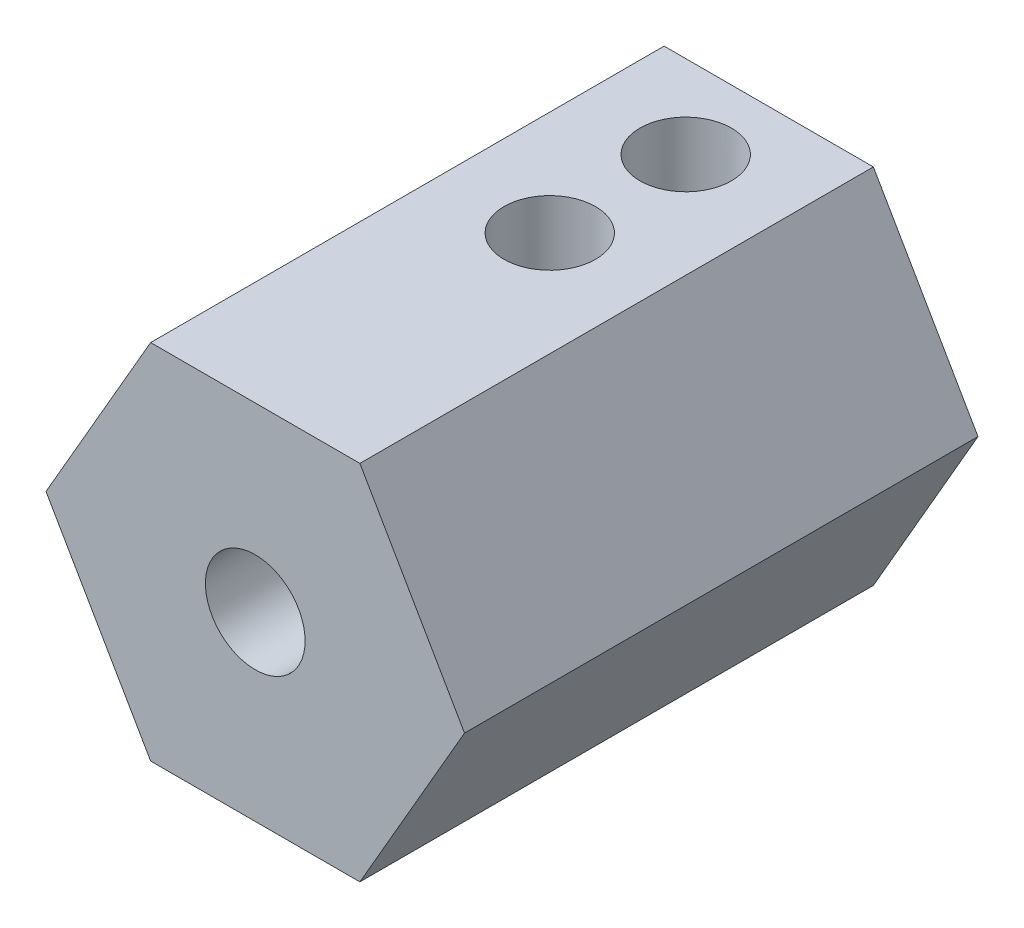
from build123d import *

# Parameters (mm, degrees)
F_01_17_MM_COMMERCIAL_DRIVE_HEX_DEPTH  = 17
F_02_START                             = -0.1
S02_SHAFT_SEAT_R                       = 2.025
F_02_SHAFT_SEAT_DEPTH                  = 10.1
F_03_START                             = 9.99
S03_OUTBOARD_M4_THREAD_ENVELOPE_R      = 1.65
F_03_OUTBOARD_M4_THREAD_ENVELOPE_DEPTH = 7.11
S04_RADIAL_M3_SET_SCREW_1_R            = 1.515
F_04_RADIAL_M3_SET_SCREW_1_DEPTH       = 7
S05_RADIAL_M3_SET_SCREW_2_R            = 1.515
F_05_RADIAL_M3_SET_SCREW_2_DEPTH       = 7


with BuildPart() as part:
    # S01 - 17 mm commercial drive hex → 01 - 17 mm commercial drive hex (new body)
    with BuildSketch(Plane.XY):
        Polygon((6.92820323, 0), (3.464101615, 6), (-3.464101615, 6), (-6.92820323, 0), (-3.464101615, -6), (3.464101615, -6), align=None)
    extrude(amount=F_01_17_MM_COMMERCIAL_DRIVE_HEX_DEPTH)

    # S02 - Shaft seat → 02 - Shaft seat (cut)
    with BuildSketch(Plane.XY.offset(F_02_START)):
        Circle(S02_SHAFT_SEAT_R)
    extrude(amount=F_02_SHAFT_SEAT_DEPTH, mode=Mode.SUBTRACT)

    # S03 - Outboard M4 thread envelope → 03 - Outboard M4 thread envelope (cut)
    with BuildSketch(Plane.XY.offset(F_03_START)):
        Circle(S03_OUTBOARD_M4_THREAD_ENVELOPE_R)
    extrude(amount=F_03_OUTBOARD_M4_THREAD_ENVELOPE_DEPTH, mode=Mode.SUBTRACT)

    # S04 - Radial M3 set screw 1 → 04 - Radial M3 set screw 1 (cut)
    with BuildSketch(Plane(origin=(0, 0, 0), x_dir=(1, 0, 0), z_dir=(0, 1, 0))):
        with Locations(Location((0, -2.75, 0), (0, 0, 90))):
            Circle(S04_RADIAL_M3_SET_SCREW_1_R)
    extrude(amount=F_04_RADIAL_M3_SET_SCREW_1_DEPTH, mode=Mode.SUBTRACT)

    # S05 - Radial M3 set screw 2 → 05 - Radial M3 set screw 2 (cut)
    with BuildSketch(Plane(origin=(0, 0, 0), x_dir=(1, 0, 0), z_dir=(0, 1, 0))):
        with Locations(Location((0, -7.25, 0), (0, 0, 90))):
            Circle(S05_RADIAL_M3_SET_SCREW_2_R)
    extrude(amount=F_05_RADIAL_M3_SET_SCREW_2_DEPTH, mode=Mode.SUBTRACT)


solid = part.part
